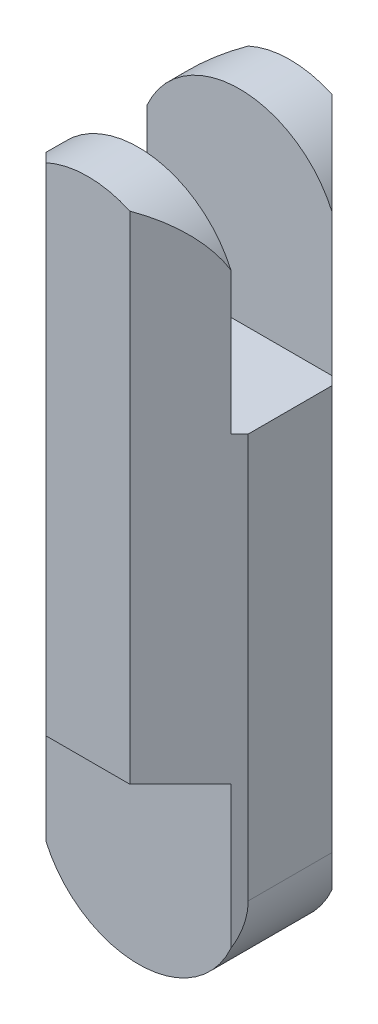
from build123d import *

# Parameters (mm, degrees)
EXTRUDE_1_DEPTH     = 70
CUT_EXTRUDE_1_DEPTH = 66
CUT_EXTRUDE_2_DEPTH = 5
CUT_EXTRUDE_START   = -5
CUT_EXTRUDE_3_DEPTH = 5
SKETCH_6_W          = 20
SKETCH_6_H          = 20
CUT_EXTRUDE_4_DEPTH = 5
CUT_EXTRUDE_5_DEPTH = 30


with BuildPart() as part:
    # 草图1 → 凸台-拉伸1 (new body)
    with BuildSketch(Plane(origin=(0, 0, 0), x_dir=(1, 0, 0), z_dir=(0, 1, 0))):
        Polygon((10, 4.142135624), (4.142135624, 10), (-4.142135624, 10), (-10, 4.142135624), (-10, -4.142135624), (-4.142135624, -10), (4.142135624, -10), (10, -4.142135624), align=None)
    extrude(amount=EXTRUDE_1_DEPTH)

    # 草图2 → 切除-拉伸1 (cut)
    with BuildSketch(Plane.XY.offset(10)):
        with BuildLine():
            Line((-10, 10), (-10, -2.389295552))
            Line((-10, -2.389295552), (10, -2.389295552))
            Line((10, -2.389295552), (10, 10))
            ThreePointArc((10, 10), (0, 0), (-10, 10))
        make_face()
    extrude(amount=-CUT_EXTRUDE_1_DEPTH, mode=Mode.SUBTRACT)

    # 草图4 → 切除-拉伸2 (cut)
    with BuildSketch(Plane.XY.offset(10)):
        with BuildLine():
            Line((-10, 10), (-10, 20))
            Line((-10, 20), (10, 20))
            Line((10, 20), (10, 10))
            ThreePointArc((10, 10), (0, 0), (-10, 10))
        make_face()
    extrude(amount=-CUT_EXTRUDE_2_DEPTH, mode=Mode.SUBTRACT)

    # 草图5 → 切除-拉伸3 (cut)
    with BuildSketch(Plane(origin=(0, 0, -10), x_dir=(-1, 0, 0), z_dir=(0, 0, -1)).offset(CUT_EXTRUDE_START)):
        with BuildLine():
            Line((-10, 10), (-10, 20))
            Line((-10, 20), (10, 20))
            Line((10, 20), (10, 10))
            ThreePointArc((10, 10), (0, 0), (-10, 10))
        make_face()
    extrude(amount=CUT_EXTRUDE_3_DEPTH, mode=Mode.SUBTRACT)

    # 草图6 → 切除-拉伸4 (cut, symmetric)
    with BuildSketch(Plane.XY):
        with Locations((0, 60)):
            Rectangle(SKETCH_6_W, SKETCH_6_H)
    extrude(amount=CUT_EXTRUDE_4_DEPTH, both=True, mode=Mode.SUBTRACT)

    # 草图7 → 切除-拉伸5 (cut)
    with BuildSketch(Plane.XY.offset(10)):
        with BuildLine():
            Line((-10, 60), (-10, 77.826040088))
            Line((-10, 77.826040088), (10, 77.826040088))
            Line((10, 77.826040088), (10, 60))
            ThreePointArc((10, 60), (0, 70), (-10, 60))
        make_face()
    extrude(amount=-CUT_EXTRUDE_5_DEPTH, mode=Mode.SUBTRACT)


solid = part.part
